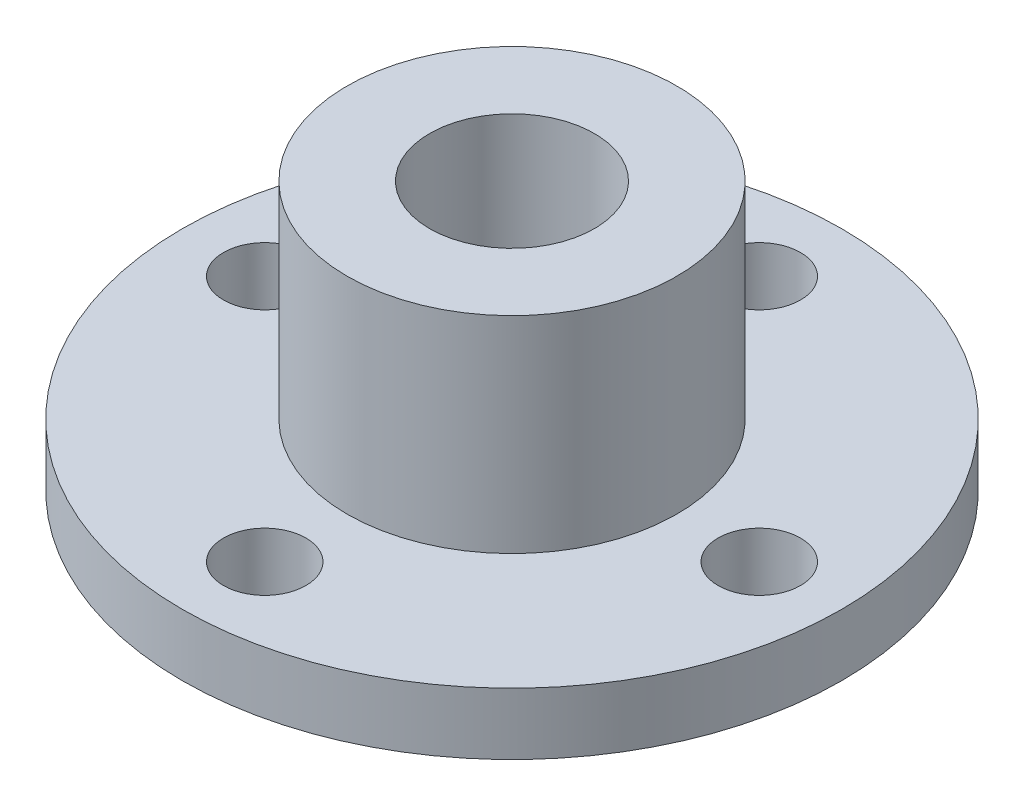
from build123d import *

# Parameters (mm, degrees)
SKETCH_1_R          = 16
EXTRUDE_1_DEPTH     = 3
SKETCH_2_R          = 8
EXTRUDE_2_DEPTH     = 10
SKETCH_3_R          = 4
CUT_EXTRUDE_1_DEPTH = 13
SKETCH_4_R          = 2
CUT_EXTRUDE_2_DEPTH = 3


with BuildPart() as part:
    # 草图1 → 凸台-拉伸1 (new body)
    with BuildSketch(Plane(origin=(0, 0, 0), x_dir=(1, 0, 0), z_dir=(0, 1, 0))):
        with Locations(Location((0, 0, 0), (0, 0, 270))):
            Circle(SKETCH_1_R)
    extrude(amount=EXTRUDE_1_DEPTH)

    # 草图2 → 凸台-拉伸2 (add)
    with BuildSketch(Plane(origin=(0, 3, 0), x_dir=(1, 0, 0), z_dir=(0, 1, 0))):
        with Locations(Location((0, 0, 0), (0, 0, 270))):
            Circle(SKETCH_2_R)
    extrude(amount=EXTRUDE_2_DEPTH)

    # 草图3 → 切除-拉伸1 (cut)
    with BuildSketch(Plane(origin=(0, 13, 0), x_dir=(1, 0, 0), z_dir=(0, 1, 0))):
        with Locations(Location((0, 0, 0), (0, 0, 270))):
            Circle(SKETCH_3_R)
    extrude(amount=-CUT_EXTRUDE_1_DEPTH, mode=Mode.SUBTRACT)

    # 草图4 → 切除-拉伸2 (cut)
    with BuildSketch(Plane.XZ):
        with Locations(Location((0, 12, 0), (0, 0, 270))):
            Circle(SKETCH_4_R)
        with Locations(Location((12, 0, 0), (0, 0, 270))):
            Circle(SKETCH_4_R)
        with Locations(Location((0, -12, 0), (0, 0, 270))):
            Circle(SKETCH_4_R)
        with Locations(Location((-12, 0, 0), (0, 0, 270))):
            Circle(SKETCH_4_R)
    extrude(amount=-CUT_EXTRUDE_2_DEPTH, mode=Mode.SUBTRACT)


solid = part.part
